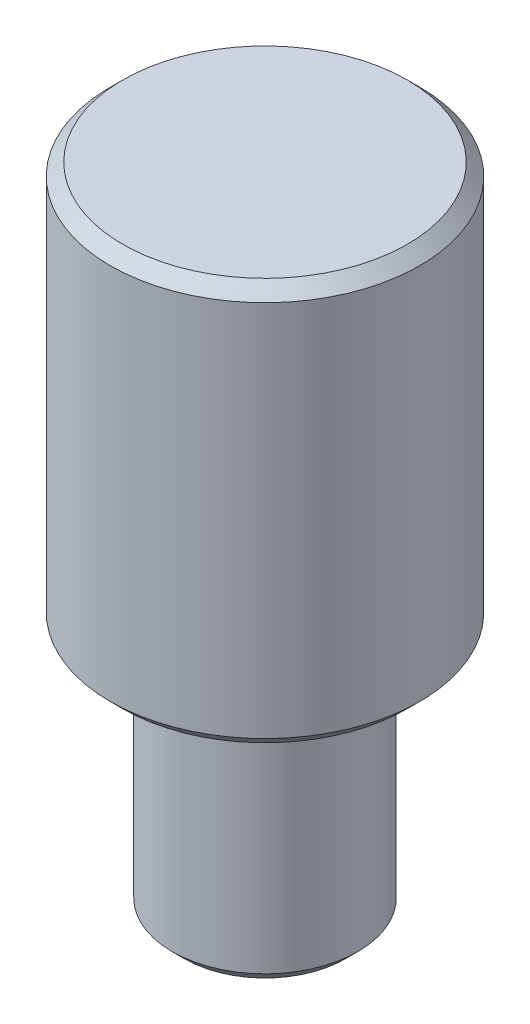
from build123d import *

# Parameters (mm, degrees)
CHAMFER1_SIZE = 2
CHAMFER2_SIZE = 2


with BuildPart() as part:
    # Sketch1 → Revolve1 (revolve)
    with BuildSketch(Plane.XY, mode=Mode.PRIVATE) as revolve1_sk:
        Polygon((0, 0), (25, 0), (25, -65), (15, -65), (15, -105), (0, -105), align=None)
    revolve(revolve1_sk.sketch.rotate(Axis((0, 0, 0), (0, -1, 0)), 90), axis=Axis((0, 0, 0), (0, -1, 0)))

    # Chamfer1
    chamfer1_edges = [part.edges().sort_by_distance(p)[0] for p in [
        (0, -105, -15),
    ]]
    chamfer(chamfer1_edges, length=CHAMFER1_SIZE)

    # Chamfer2
    chamfer2_edges = [part.edges().sort_by_distance(p)[0] for p in [
        (0, -65, -25),
        (0, 0, -25),
    ]]
    chamfer(chamfer2_edges, length=CHAMFER2_SIZE)


solid = part.part
